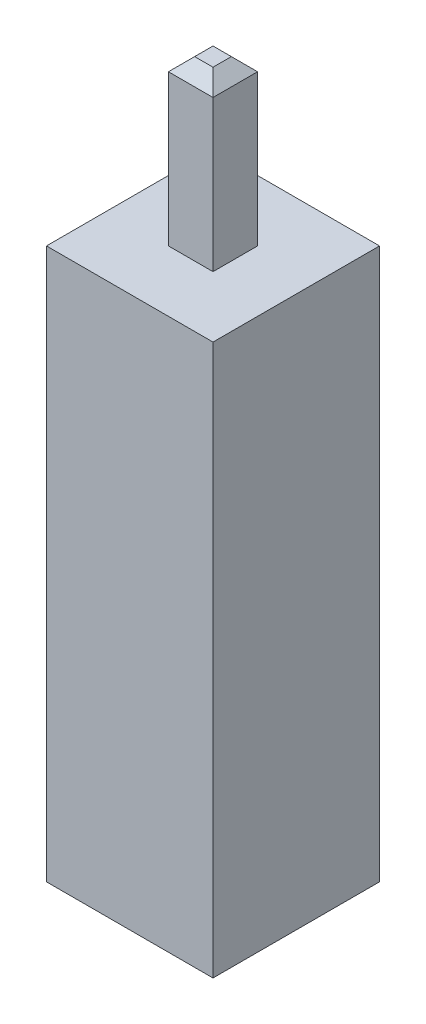
from build123d import *

# Parameters (mm, degrees)
SKETCH1_W                = 2.54
SKETCH1_H                = 2.54
SKETCH1_W_2              = 0.68
SKETCH1_H_2              = 0.68
BOSS_EXTRUDE1_DEPTH      = 8.4
SKETCH2_W                = 1
SKETCH2_H                = 1
CUT_EXTRUDE1_DEPTH       = 7
CHAMFER1_SIZE            = 0.5
BOSS_EXTRUDE2_DEPTH      = 0.5
BOSS_EXTRUDE2_DEPTH_BACK = 0.5
SKETCH4_W                = 0.16
SKETCH4_H                = 6.500631374
BOSS_EXTRUDE3_DEPTH      = 3
BOSS_EXTRUDE3_DEPTH_BACK = 1
SKETCH7_W                = 0.68
SKETCH7_H                = 0.68
SKETCH8_W                = 1
SKETCH8_H                = 1
SKETCH8_W_2              = 0.68
SKETCH8_H_2              = 0.68
BOSS_EXTRUDE4_DEPTH      = 0.499368626
CHAMFER2_SIZE            = 0.2


with BuildPart() as part:
    # Sketch1 → Boss-Extrude1 (new body)
    with BuildSketch(Plane(origin=(0, 0, 0), x_dir=(1, 0, 0), z_dir=(0, 1, 0))):
        Rectangle(SKETCH1_W, SKETCH1_H)
        Rectangle(SKETCH1_W_2, SKETCH1_H_2, mode=Mode.SUBTRACT)
    extrude(amount=BOSS_EXTRUDE1_DEPTH)

    # Sketch2 → Cut-Extrude1 (cut)
    with BuildSketch(Plane(origin=(0, 8.4, 0), x_dir=(1, 0, 0), z_dir=(0, 1, 0))):
        Rectangle(SKETCH2_W, SKETCH2_H)
    extrude(amount=-CUT_EXTRUDE1_DEPTH, mode=Mode.SUBTRACT)

    # Chamfer1
    chamfer1_edges = [part.edges().sort_by_distance(p)[0] for p in [
        (0.34, 0, 0),
        (0, 0, -0.34),
        (-0.34, 0, 0),
        (0, 0, 0.34),
    ]]
    chamfer(chamfer1_edges, length=CHAMFER1_SIZE)

    # Sketch4 → Boss-Extrude2 (add, two sides: drawn at the far end of the back side and taken through both)
    with BuildSketch(Plane.XY.offset(-BOSS_EXTRUDE2_DEPTH_BACK)):
        with Locations((-0.42, 4.650315687)):
            Rectangle(SKETCH4_W, SKETCH4_H)
        with Locations((0.42, 4.650315687)):
            Rectangle(SKETCH4_W, SKETCH4_H)
    extrude(amount=BOSS_EXTRUDE2_DEPTH + BOSS_EXTRUDE2_DEPTH_BACK)

    # Sketch7 → Boss-Extrude3 (add, two sides: drawn at the far end of the back side and taken through both)
    with BuildSketch(Plane(origin=(0, 7.900631374, 0), x_dir=(1, 0, 0), z_dir=(0, 1, 0)).offset(-BOSS_EXTRUDE3_DEPTH_BACK)):
        Rectangle(SKETCH7_W, SKETCH7_H)
    extrude(amount=BOSS_EXTRUDE3_DEPTH + BOSS_EXTRUDE3_DEPTH_BACK)

    # Sketch8 → Boss-Extrude4 (add)
    with BuildSketch(Plane(origin=(0, 8.4, 0), x_dir=(1, 0, 0), z_dir=(0, 1, 0))):
        Rectangle(SKETCH8_W, SKETCH8_H)
        Rectangle(SKETCH8_W_2, SKETCH8_H_2, mode=Mode.SUBTRACT)
    extrude(amount=-BOSS_EXTRUDE4_DEPTH)

    # Chamfer2
    chamfer2_edges = [part.edges().sort_by_distance(p)[0] for p in [
        (0.34, 10.900631374, 0),
        (0, 10.900631374, -0.34),
        (-0.34, 10.900631374, 0),
        (0, 10.900631374, 0.34),
    ]]
    chamfer(chamfer2_edges, length=CHAMFER2_SIZE)


solid = part.part
